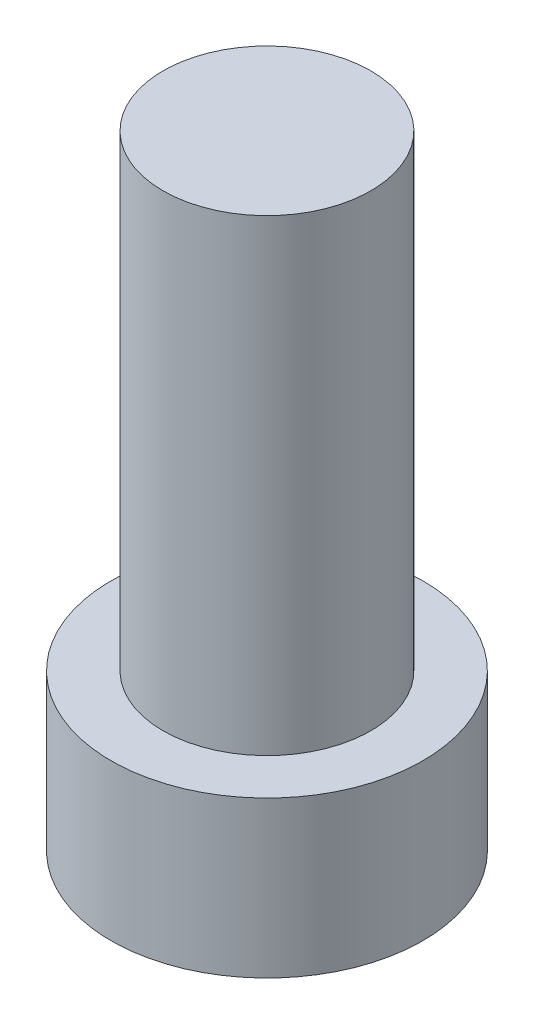
from build123d import *


with BuildPart() as part:
    # Sketch1 → Revolve1 (revolve)
    with BuildSketch(Plane.XY, mode=Mode.PRIVATE) as revolve1_sk:
        Polygon((0, 0), (4.7625, 0), (4.7625, 4.7625), (3.175, 4.7625), (3.175, 19.05), (0, 19.05), align=None)
    revolve(revolve1_sk.sketch.rotate(Axis((0, 0, 0), (0, 1, 0)), 90), axis=Axis((0, 0, 0), (0, 1, 0)))


solid = part.part
